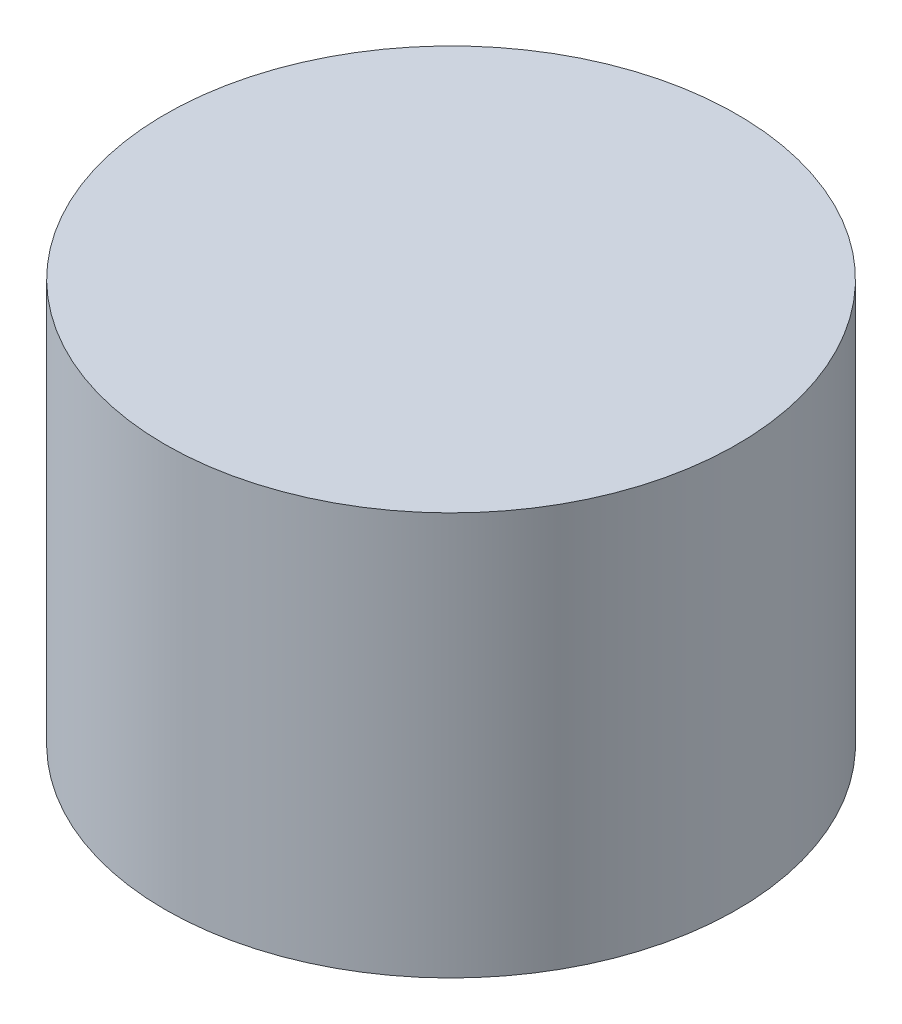
from build123d import *

# Parameters (mm, degrees)
SKETCH_1_R      = 7.1
EXTRUDE_1_DEPTH = 10


with BuildPart() as part:
    # 草图1 → 凸台-拉伸1 (new body)
    with BuildSketch(Plane(origin=(0, 0, 0), x_dir=(1, 0, 0), z_dir=(0, 1, 0))):
        with Locations(Location((0, 0, 0), (0, 0, 270))):
            Circle(SKETCH_1_R)
    extrude(amount=EXTRUDE_1_DEPTH)


solid = part.part
